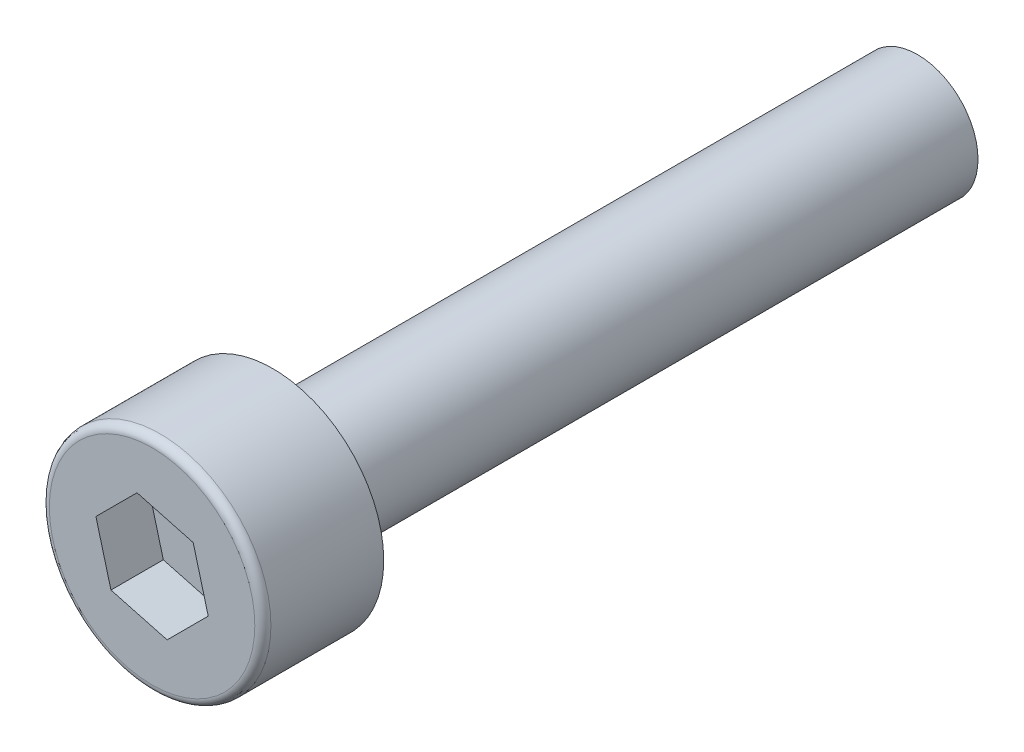
from build123d import *

# Parameters (mm, degrees)
SKETCH_1_R          = 2.75
EXTRUDE_1_DEPTH     = 3
CUT_EXTRUDE_1_DEPTH = 1.3
SKETCH_3_R          = 1.5
EXTRUDE_2_DEPTH     = 16
FILLET_1_R          = 0.2


with BuildPart() as part:
    # 草图1 → 凸台-拉伸1 (new body)
    with BuildSketch(Plane.XY):
        Circle(SKETCH_1_R)
    extrude(amount=EXTRUDE_1_DEPTH)

    # 草图2 → 切除-拉伸1 (cut)
    with BuildSketch(Plane.XY.offset(3)):
        Polygon((-1.020620726, -1.020620726), (0.373573113, -1.39419384), (1.39419384, -0.373573113), (1.020620726, 1.020620726), (-0.373573113, 1.39419384), (-1.39419384, 0.373573113), align=None)
    extrude(amount=-CUT_EXTRUDE_1_DEPTH, mode=Mode.SUBTRACT)

    # 草图3 → 凸台-拉伸2 (add)
    with BuildSketch(Plane(origin=(0, 0, 0), x_dir=(-1, 0, 0), z_dir=(0, 0, -1))):
        with Locations(Location((0, 0, 0), (0, 0, 180))):
            Circle(SKETCH_3_R)
    extrude(amount=EXTRUDE_2_DEPTH)

    # 圆角1
    fillet_1_edges = [part.edges().sort_by_distance(p)[0] for p in [
        (-2.75, 0, 3),
    ]]
    fillet(fillet_1_edges, radius=FILLET_1_R)


solid = part.part
